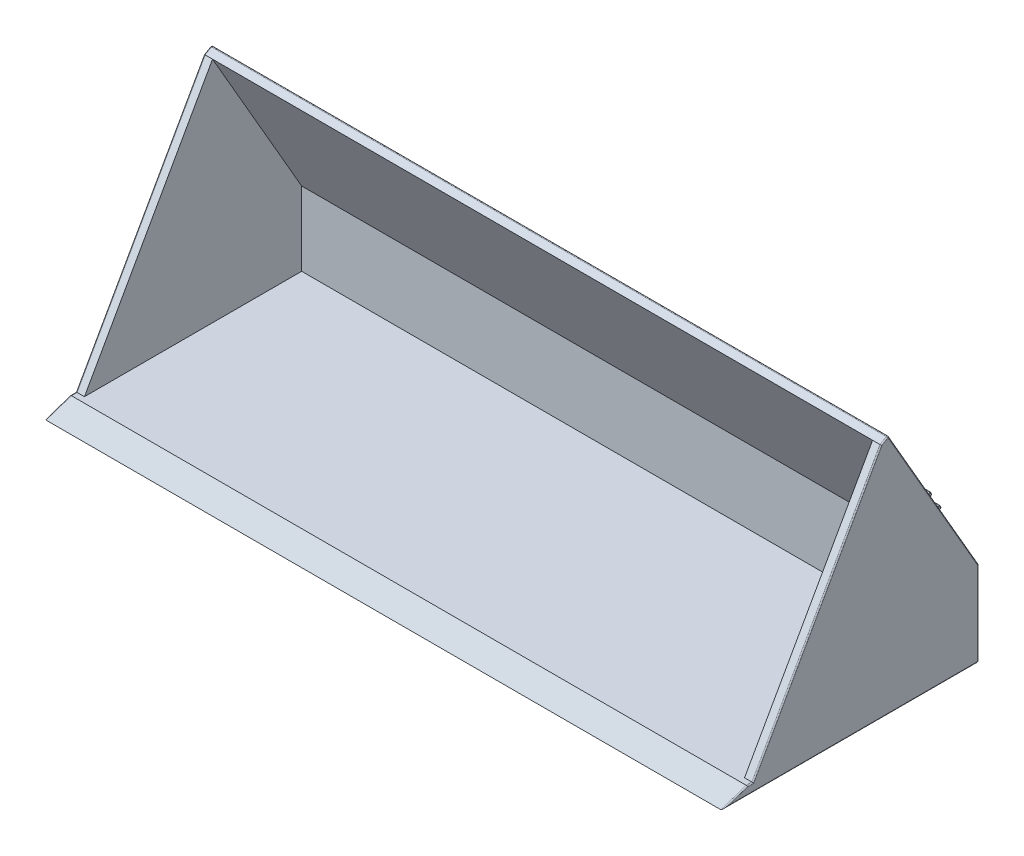
from build123d import *

# Parameters (mm, degrees)
EXTRUDE_1_DEPTH = 117
EXTRUDE_2_DEPTH = 1.5
EXTRUDE_3_DEPTH = 1.5
EXTRUDE_START   = -6
EXTRUDE_4_DEPTH = 108
EXTRUDE_5_DEPTH = 108
FILLET_1_R      = 0.1
FILLET_2_R      = 0.2


with BuildPart() as part:
    # 草图1 → 凸台-拉伸1 (new body)
    with BuildSketch(Plane(origin=(0, 0, 0), x_dir=(0, 0, -1), z_dir=(1, 0, 0))):
        Polygon((0, 0), (-40, 0), (-45.5, 0), (-41, 1.5), (-40, 1.5), (-1.5, 1.5), (-1.5, 14.598076211), (-17.299038106, 41.962812921), (-16, 42.712812921), (0, 15), align=None)
    extrude(amount=EXTRUDE_1_DEPTH)

    # 草图2 → 凸台-拉伸2 (add)
    with BuildSketch(Plane(origin=(117, 0, 0), x_dir=(0, 0, -1), z_dir=(1, 0, 0))):
        Polygon((-41, 1.5), (-40, 1.5), (-17.299038106, 41.962812921), (-16, 42.712812921), (0, 15), (0, 0), (-45.5, 0), align=None)
    extrude(amount=EXTRUDE_2_DEPTH)

    # 草图3 → 凸台-拉伸3 (add)
    with BuildSketch(Plane.ZY):
        Polygon((41, 1.5), (40, 1.5), (17.299038106, 41.962812921), (16, 42.712812921), (0, 15), (0, 0), (45.5, 0), align=None)
    extrude(amount=EXTRUDE_3_DEPTH)

    # 草图4 → 凸台-拉伸4 (add)
    with BuildSketch(Plane.ZY.offset(1.5).offset(EXTRUDE_START)):
        with BuildLine():
            Line((0, 7.5), (0, 6))
            Line((0, 6), (-0.677124344, 6))
            ThreePointArc((-0.677124344, 6), (-1.088161527, 5.719957697), (-1.555590279, 5.55))
            Line((-1.555590279, 5.55), (-2.5, 5.55))
            Line((-2.5, 5.55), (-2.5, 6.056624327))
            Line((-2.5, 6.056624327), (0, 7.5))
        make_face()
    extrude_4 = extrude(amount=-EXTRUDE_4_DEPTH)

    # 镜向1: 凸台-拉伸4 across plane
    add(extrude_4.mirror(Plane(origin=(0, 7.5, 0), x_dir=(0, 0, 1), z_dir=(0, -1, 0))))

    # 草图5 → 凸台-拉伸5 (add)
    with BuildSketch(Plane.ZY.offset(1.5).offset(EXTRUDE_START)):
        with BuildLine():
            Line((3.75, 21.495190528), (4.5, 22.794228634))
            Line((4.5, 22.794228634), (3.913593116, 23.132790806))
            ThreePointArc((3.913593116, 23.132790806), (3.697645625, 23.580833146), (3.3778193, 23.961735205))
            Line((3.3778193, 23.961735205), (2.559936491, 24.433940066))
            Line((2.559936491, 24.433940066), (2.306624327, 23.995190528))
            Line((2.306624327, 23.995190528), (3.75, 21.495190528))
        make_face()
    extrude_5 = extrude(amount=-EXTRUDE_5_DEPTH)

    # 镜向2: 凸台-拉伸5 across plane
    add(extrude_5.mirror(Plane(origin=(0, 17.745190528, 10.245190528), x_dir=(0, -0.49999999999999695, 0.8660254037844404), z_dir=(0, 0.8660254037844406, 0.49999999999999684))))

    # 圆角1
    fillet_1_edges = [part.edges().sort_by_distance(p)[0] for p in [
        (112.5, 24.214565297, 2.433280409),
        (58.5, 23.995190528, 2.306624327),
        (58.5, 24.433940066, 2.559936491),
        (4.5, 24.214565297, 2.433280409),
        (58.5, 21.495190528, 0.863248654),
        (4.5, 21.27581576, 0.736592572),
        (58.5, 21.056440991, 0.609936491),
        (112.5, 21.27581576, 0.736592572),
        (58.5, 6.056624327, -2.5),
        (112.5, 5.803312164, -2.5),
        (58.5, 5.55, -2.5),
        (4.5, 5.803312164, -2.5),
        (4.5, 9.196687836, -2.5),
        (58.5, 8.943375673, -2.5),
        (58.5, 9.45, -2.5),
        (112.5, 9.196687836, -2.5),
    ]]
    fillet(fillet_1_edges, radius=FILLET_1_R)

    # 圆角2
    fillet_2_edges = [part.edges().sort_by_distance(p)[0] for p in [
        (118.5, 0.75, 43.25),
        (118.5, 1.5, 40.5),
        (118.5, 21.731406461, 28.649519053),
        (118.5, 42.337812921, 16.649519053),
        (118.5, 28.856406461, 8),
        (118.5, 7.5, 0),
        (118.5, 0, 22.75),
        (-1.5, 42.337812921, 16.649519053),
        (-1.5, 21.731406461, 28.649519053),
        (-1.5, 1.5, 40.5),
        (-1.5, 0.75, 43.25),
        (-1.5, 0, 22.75),
        (-1.5, 7.5, 0),
        (-1.5, 28.856406461, 8),
        (58.5, 0, 0),
        (58.5, 15, 0),
        (58.5, 42.712812921, 16),
    ]]
    fillet(fillet_2_edges, radius=FILLET_2_R)


solid = part.part
